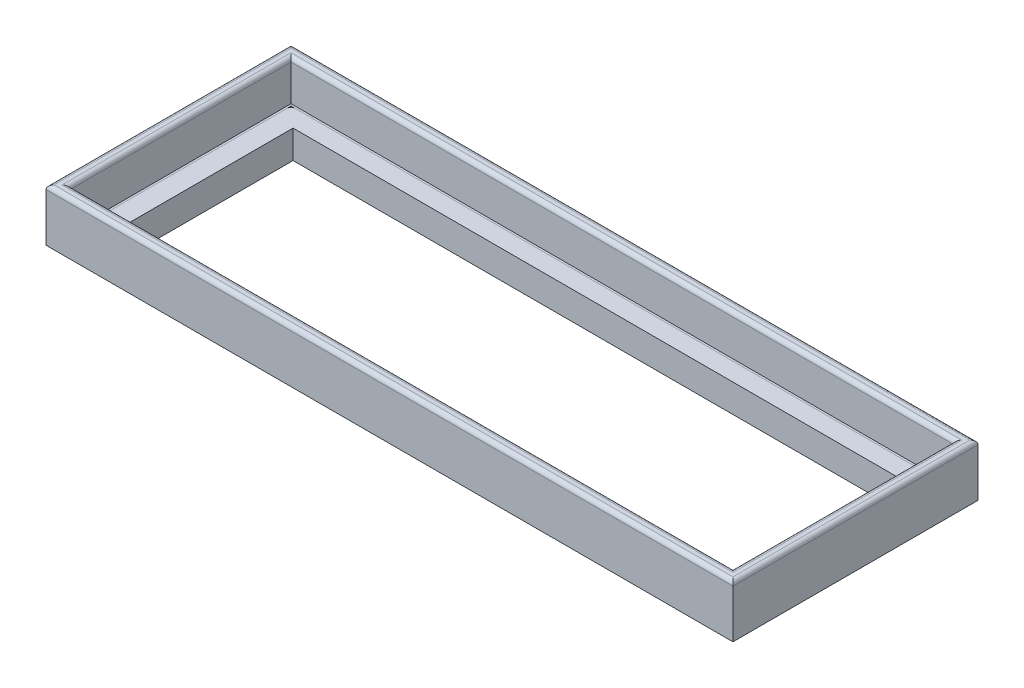
from build123d import *

# Parameters (mm, degrees)
SKETCH1_W           = 171
SKETCH1_H           = 61
SKETCH1_W_2         = 165
SKETCH1_H_2         = 55
BOSS_EXTRUDE1_DEPTH = 10
SKETCH1_5_W         = 164
SKETCH1_5_H         = 54
BOSS_EXTRUDE2_DEPTH = 7
SKETCH1_6_W         = 171
SKETCH1_6_H         = 61
SKETCH1_6_W_2       = 164
SKETCH1_6_H_2       = 54
BOSS_EXTRUDE3_DEPTH = 3
FILLET1_R           = 1
FILLET2_R           = 1
SKETCH2_W           = 154
SKETCH2_H           = 45
CUT_EXTRUDE1_DEPTH  = 92.326337932


with BuildPart() as part:
    # Sketch1 → Boss-Extrude1 (new body)
    with BuildSketch(Plane(origin=(0, 0, 0), x_dir=(1, 0, 0), z_dir=(0, 1, 0))):
        Rectangle(SKETCH1_W, SKETCH1_H)
        Rectangle(SKETCH1_W_2, SKETCH1_H_2, mode=Mode.SUBTRACT)
    extrude(amount=BOSS_EXTRUDE1_DEPTH)

    # Sketch1<6> → Boss-Extrude3 (add)
    with BuildSketch(Plane(origin=(0, 0, 0), x_dir=(1, 0, 0), z_dir=(0, 1, 0))):
        Rectangle(SKETCH1_6_W, SKETCH1_6_H)
        Rectangle(SKETCH1_6_W_2, SKETCH1_6_H_2, mode=Mode.SUBTRACT)
    extrude(amount=-BOSS_EXTRUDE3_DEPTH)

    # Fillet2
    fillet2_edges = [part.edges().sort_by_distance(p)[0] for p in [
        (0, 10, -27.5),
        (-82.5, 10, 0),
        (0, 10, 27.5),
        (82.5, 10, 0),
        (0, 10, -30.5),
        (85.5, 10, 0),
        (0, 10, 30.5),
        (-85.5, 10, 0),
    ]]
    fillet(fillet2_edges, radius=FILLET2_R)


with BuildPart() as body_2:
    # Sketch1<5> → Boss-Extrude2 (new body)
    with BuildSketch(Plane(origin=(0, 0, 0), x_dir=(1, 0, 0), z_dir=(0, 1, 0))):
        Rectangle(SKETCH1_5_W, SKETCH1_5_H)
    extrude(amount=-BOSS_EXTRUDE2_DEPTH)

    # Fillet1
    fillet1_edges = [body_2.edges().sort_by_distance(p)[0] for p in [
        (0, -7, 27),
        (82, -7, 0),
        (0, -7, -27),
        (-82, -7, 0),
        (82, -3.5, -27),
        (82, -3.5, 27),
        (0, 0, 27),
        (-82, -3.5, -27),
    ]]
    fillet(fillet1_edges, radius=FILLET1_R)

    # Sketch2 → Cut-Extrude1 (cut, through all)
    with BuildSketch(Plane(origin=(0, 0, 0), x_dir=(1, 0, 0), z_dir=(0, 1, 0))):
        Rectangle(SKETCH2_W, SKETCH2_H)
    extrude(amount=-CUT_EXTRUDE1_DEPTH, mode=Mode.SUBTRACT)


solid = Compound([part.part, body_2.part])
